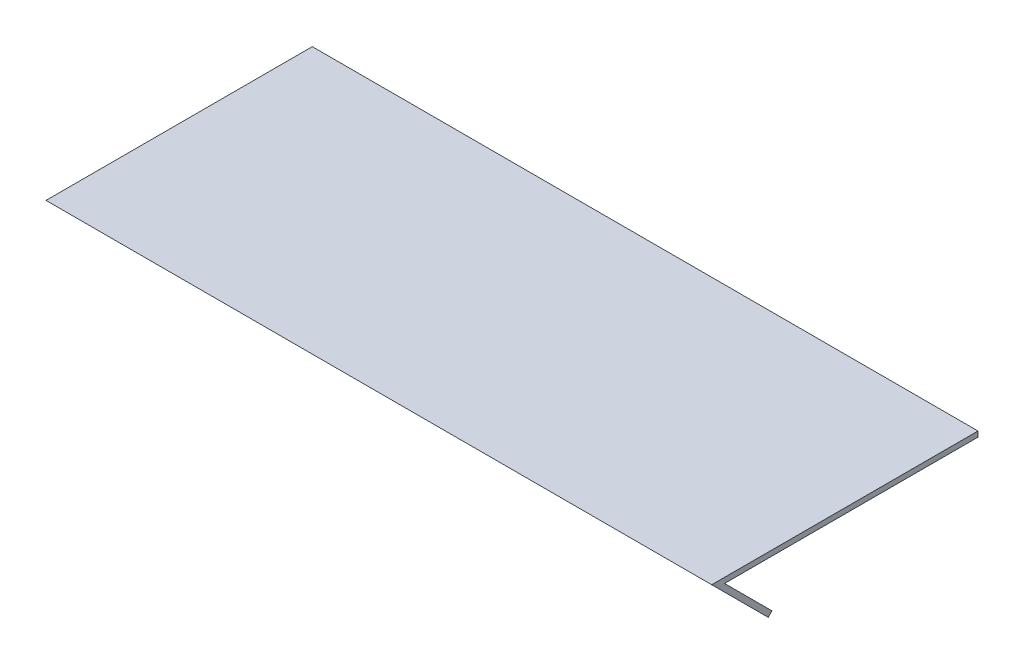
from build123d import *

# Parameters (mm, degrees)
BOSS_EXTRU_1_DEPTH = 125


with BuildPart() as part:
    # Esquisse1 → Boss.-Extru.1 (new, symmetric)
    with BuildSketch(Plane(origin=(0, 0, 0), x_dir=(0, 0, -1), z_dir=(1, 0, 0))):
        Polygon((0, 0), (17.798989873, -17.798989873), (16.384776311, -19.213203436), (-4.828427125, 2), (95.171572875, 2), (95.171572875, 0), align=None)
    extrude(amount=BOSS_EXTRU_1_DEPTH, both=True)


solid = part.part
